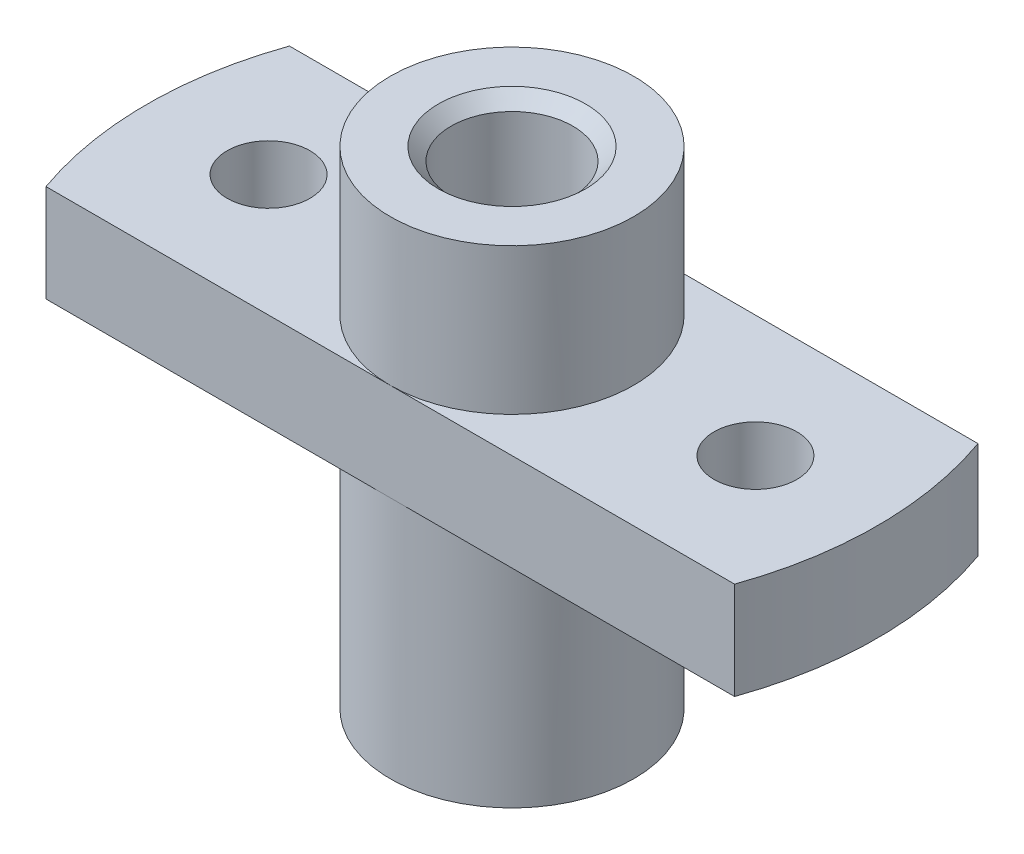
from build123d import *

# Parameters (mm, degrees)
M3_CLEARANCE_HOLE1_D = 3.4
SKETCH9_OUTSIDE_W    = 41.38
SKETCH9_OUTSIDE_H    = 41.38
SKETCH9_OUTSIDE_W_2  = 30
SKETCH9_OUTSIDE_H_2  = 10
CUT_EXTRUDE1_DEPTH   = 26.416530054


with BuildPart() as part:
    # Sketch2 → Revolve1 (revolve)
    with BuildSketch(Plane.XY):
        Polygon((0, 0), (-5, 0), (-5, 10), (-15, 10), (-15, 14), (-5, 14), (-5, 20), (0, 20), align=None)
    revolve(axis=Axis((0, 20, 0), (0, -1, 0)))

    # M3 Clearance Hole1 (through all)
    with Locations(Plane(origin=(0, 14, 0), x_dir=(-1, 0, 0), z_dir=(0, 1, 0))):
        with Locations((10, 0), (-10, 0)):
            Hole(M3_CLEARANCE_HOLE1_D / 2)

    # Sketch8 → M6 Tapped Hole1 (revolve, cut)
    with BuildSketch(Plane(origin=(0, 20, 0), x_dir=(0, 0, 1), z_dir=(1, 0, 0))):
        Polygon((0, 0), (0, 20), (3.025, 20), (2.5, 19.475), (2.5, 0.525), (3.025, 0), align=None)
    revolve(axis=Axis((0, 26.35, 0), (0, -1, 0)), mode=Mode.SUBTRACT)

    # Sketch9 outside → Cut-Extrude1 (cut, through all)
    with BuildSketch(Plane(origin=(0, 14, 0), x_dir=(1, 0, 0), z_dir=(0, 1, 0))):
        Rectangle(SKETCH9_OUTSIDE_W, SKETCH9_OUTSIDE_H)
        Rectangle(SKETCH9_OUTSIDE_W_2, SKETCH9_OUTSIDE_H_2, mode=Mode.SUBTRACT)
    extrude(amount=-CUT_EXTRUDE1_DEPTH, mode=Mode.SUBTRACT)


solid = part.part
